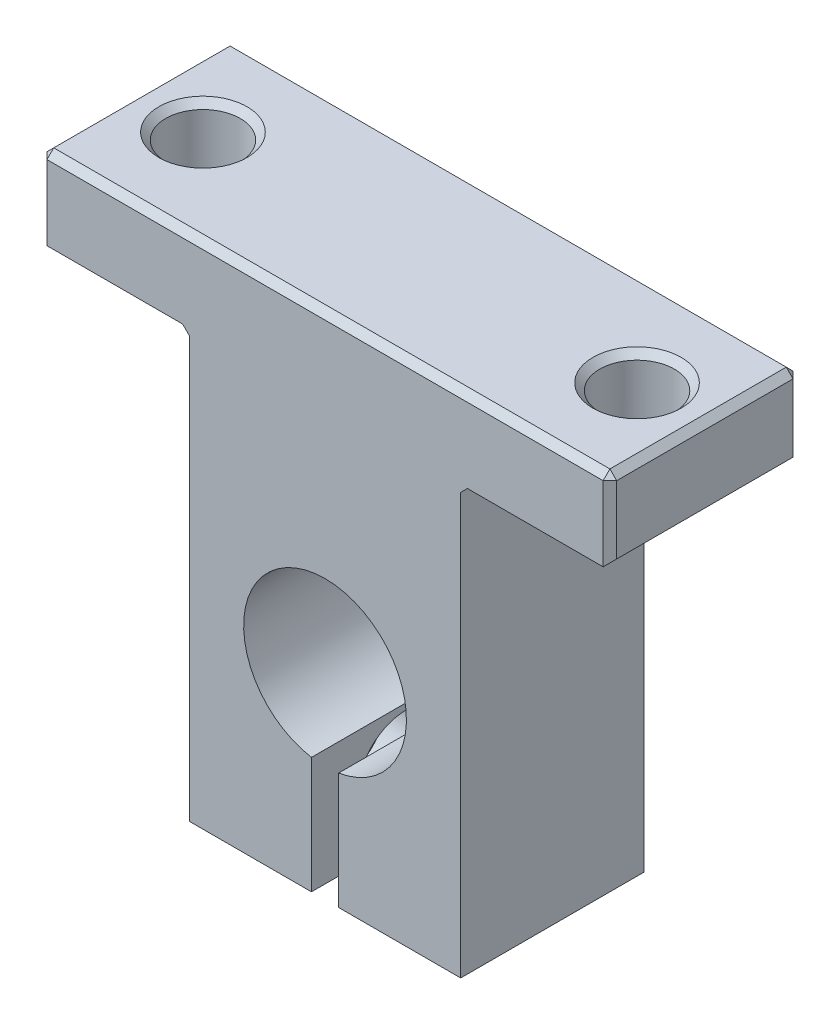
from build123d import *

# Parameters (mm, degrees)
SKETCH1_W                           = 42
SKETCH1_H                           = 37.5
BOSS_EXTRUDE1_DEPTH                 = 14
CUT_EXTRUDE1_DEPTH                  = 73.568932747
CUT_EXTRUDE2_DEPTH                  = 73.568932747
CUT_EXTRUDE3_DEPTH                  = 73.568932747
F_7_3_7_3_DIAMETER_HOLE1_D          = 7.3
F_7_3_7_3_DIAMETER_HOLE1_DEPTH      = 9
SKETCH7_R                           = 3.5
BOSS_EXTRUDE2_DEPTH                 = 4
CUT_EXTRUDE4_DEPTH                  = 2
SKETCH9_W                           = 6
SKETCH9_H                           = 14
SKETCH11_W                          = 2
SKETCH11_H                          = 2
SKETCH12_W                          = 2.75
SKETCH12_H                          = 6
F_5_5_5_5_DIAMETER_HOLE1_AT_2_COUNT = 2
F_5_5_5_5_DIAMETER_HOLE1_AT_2_PITCH = 32
CHAMFER1_SIZE                       = 0.5
FILLET1_R                           = 0.2


with BuildPart() as part:
    # Sketch1 → Boss-Extrude1 (new body)
    with BuildSketch(Plane(origin=(0, 0, 3), x_dir=(-1, 0, 0), z_dir=(0, 0, -1))):
        with Locations((-21, -38.75)):
            Rectangle(SKETCH1_W, SKETCH1_H)
    extrude(amount=-BOSS_EXTRUDE1_DEPTH)

    # Sketch2 → Cut-Extrude1 (cut, through all)
    with BuildSketch(Plane.XY.offset(17)):
        Polygon((31, -26.5), (31, -57.5), (42, -57.5), (42, -26), (31.5, -26), align=None)
    extrude(amount=-CUT_EXTRUDE1_DEPTH, mode=Mode.SUBTRACT)

    # Sketch3 → Cut-Extrude2 (cut, through all)
    with BuildSketch(Plane.XY.offset(17)):
        with BuildLine():
            Line((20, -57.5), (22, -57.5))
            Line((22, -57.5), (22, -48.916079783))
            ThreePointArc((22, -48.916079783), (21, -49), (20, -48.916079783))
            Line((20, -48.916079783), (20, -57.5))
        make_face()
    extrude(amount=-CUT_EXTRUDE2_DEPTH, mode=Mode.SUBTRACT)

    # Sketch4 → Cut-Extrude3 (cut, through all)
    with BuildSketch(Plane.XY.offset(17)):
        Polygon((11, -26.5), (10.5, -26), (0, -26), (0, -57.5), (11, -57.5), align=None)
    extrude(amount=-CUT_EXTRUDE3_DEPTH, mode=Mode.SUBTRACT)

    # Ø7.3 (7.3) Diameter Hole1
    with Locations(Plane.ZY.offset(-11)):
        with Locations((10, -53.027864045)):
            Hole(F_7_3_7_3_DIAMETER_HOLE1_D / 2, depth=F_7_3_7_3_DIAMETER_HOLE1_DEPTH)

    # Sketch9 → Cut-Revolve1 (revolve, cut)
    with BuildSketch(Plane(origin=(0, -43, 0), x_dir=(1, 0, 0), z_dir=(0, 1, 0))):
        with Locations((24, -10)):
            Rectangle(SKETCH9_W, SKETCH9_H)
    revolve(axis=Axis((21, -43, 3), (0, 0, 1)), mode=Mode.SUBTRACT)

    # Sketch11 → Revolve1 (revolve)
    with BuildSketch(Plane(origin=(0, 0, 10), x_dir=(-1, 0, 0), z_dir=(0, 0, -1)), mode=Mode.PRIVATE) as revolve1_sk:
        with Locations((-21, -52.027864045)):
            Rectangle(SKETCH11_W, SKETCH11_H)
    revolve(revolve1_sk.sketch.rotate(Axis((22, -53.027864045, 10), (-1, 0, 0)), 270), axis=Axis((22, -53.027864045, 10), (-1, 0, 0)))

    # Sketch12 → Ø5.5 (5.5) Diameter Hole1 (revolve, cut)
    with BuildSketch(Plane(origin=(37, -20, 10), x_dir=(0, 0, 1), z_dir=(1, 0, 0))):
        with Locations((1.375, 3)):
            Rectangle(SKETCH12_W, SKETCH12_H)
    f_5_5_5_5_diameter_hole1 = revolve(axis=Axis((37, -13.65, 10), (0, -1, 0)), mode=Mode.SUBTRACT)

    # Ø5.5 (5.5) Diameter Hole1 at 2: Ø5.5 (5.5) Diameter Hole1 ×2
    with Locations(*[(-i * F_5_5_5_5_DIAMETER_HOLE1_AT_2_PITCH, 0, 0) for i in range(1, F_5_5_5_5_DIAMETER_HOLE1_AT_2_COUNT)]):
        add(f_5_5_5_5_diameter_hole1, mode=Mode.SUBTRACT)

    # Chamfer1
    chamfer1_edges = [part.edges().sort_by_distance(p)[0] for p in [
        (37, -20, 7.25),
        (37, -26, 7.25),
        (26.5, -57.5, 3),
        (31.25, -26.25, 3),
        (36.75, -26, 3),
        (42, -26, 10),
        (31, -42, 3),
        (15.5, -57.5, 3),
        (20, -53.208039892, 3),
        (22, -53.208039892, 3),
        (21, -20, 17),
        (0, -23, 3),
        (0, -23, 17),
        (11, -42, 3),
        (42, -23, 3),
        (5.25, -26, 3),
        (0, -26, 10),
        (10.75, -26.25, 3),
        (21, -20, 3),
        (42, -23, 17),
        (0, -20, 10),
        (42, -20, 10),
        (21, -37, 3),
        (5, -20, 7.25),
        (5, -26, 7.25),
    ]]
    chamfer(chamfer1_edges, length=CHAMFER1_SIZE)


with BuildPart() as body_2:
    # Sketch7 → Boss-Extrude2 (new body)
    with BuildSketch(Plane(origin=(15, 0, 0), x_dir=(0, 0, -1), z_dir=(1, 0, 0))):
        with Locations(Location((-10, -53.027864045, 0), (0, 0, 180))):
            Circle(SKETCH7_R)
    extrude(amount=-BOSS_EXTRUDE2_DEPTH)

    # Sketch8 → Cut-Extrude4 (cut)
    with BuildSketch(Plane.ZY.offset(-11)):
        Polygon((11.405674452, -54.108493338), (11.638689646, -52.350828907), (10.233015194, -51.270199614), (8.594325548, -51.947234752), (8.361310354, -53.704899183), (9.766984806, -54.785528476), align=None)
    extrude(amount=-CUT_EXTRUDE4_DEPTH, mode=Mode.SUBTRACT)

    # Sketch10 → Cut-Revolve2 (revolve, cut)
    with BuildSketch(Plane.XY.offset(10), mode=Mode.PRIVATE) as cut_revolve2_sk:
        Polygon((12.999999999, -51.492364045), (12.999999999, -53.027864045), (13.886521338, -53.027864045), align=None)
    revolve(cut_revolve2_sk.sketch.rotate(Axis((12.999974999, -53.027864045, 10), (1, 0, 0)), 90), axis=Axis((12.999974999, -53.027864045, 10), (1, 0, 0)), mode=Mode.SUBTRACT)

    # Fillet1
    fillet1_edges = [body_2.edges().sort_by_distance(p)[0] for p in [
        (11, -53.027864045, 6.5),
    ]]
    fillet(fillet1_edges, radius=FILLET1_R)


solid = Compound([part.part, body_2.part])
